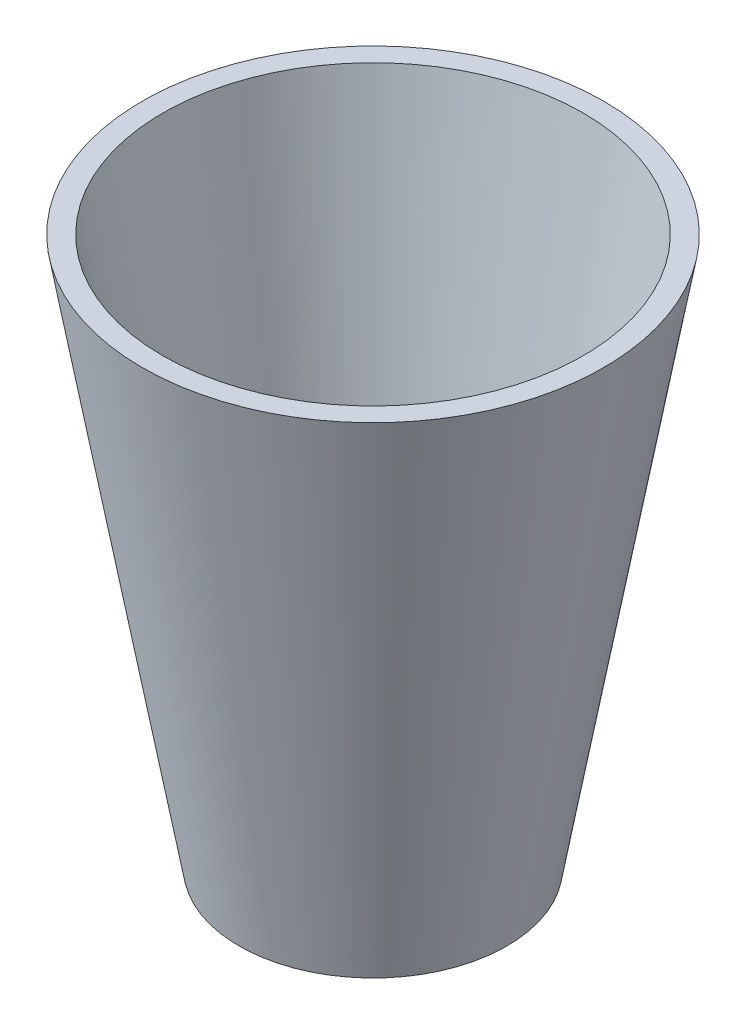
from build123d import *


with BuildPart() as part:
    # Croquis1 → Revolución1 (revolve)
    with BuildSketch(Plane(origin=(0, 0, 0), x_dir=(0, 0, -1), z_dir=(1, 0, 0))):
        Polygon((0, 0), (22.875, 0), (39.4, 93.8), (35.896870572, 93.8), (19.979666415, 3.45), (0, 3.45), align=None)
    revolve(axis=Axis((0, 0, 0), (0, 1, 0)))


solid = part.part
